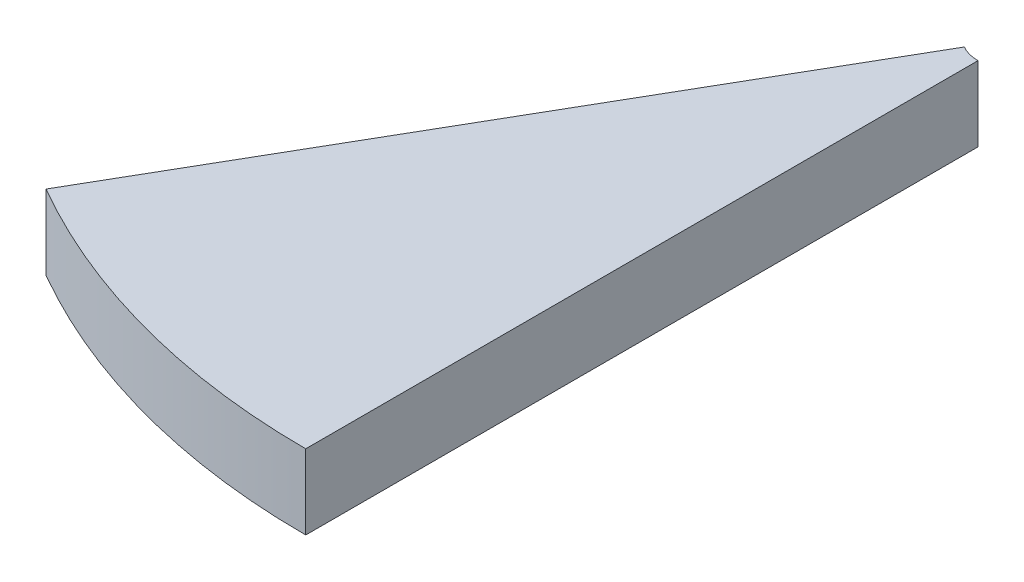
from build123d import *

# Parameters (mm, degrees)
BOSS_EXTRUDE1_DEPTH = 40


with BuildPart() as part:
    # Sketch1 → Boss-Extrude1 (new body)
    with BuildSketch(Plane(origin=(0, 0, 0), x_dir=(1, 0, 0), z_dir=(0, 1, 0))):
        with BuildLine():
            ThreePointArc((0, -20), (-5.176380902, -19.318516526), (-10, -17.320508076))
            Line((-10, -17.320508076), (-190, -329.089653438))
            ThreePointArc((-190, -329.089653438), (-98.351237139, -367.05181399), (0, -380))
            Line((0, -380), (0, -20))
        make_face()
    extrude(amount=BOSS_EXTRUDE1_DEPTH)


solid = part.part
